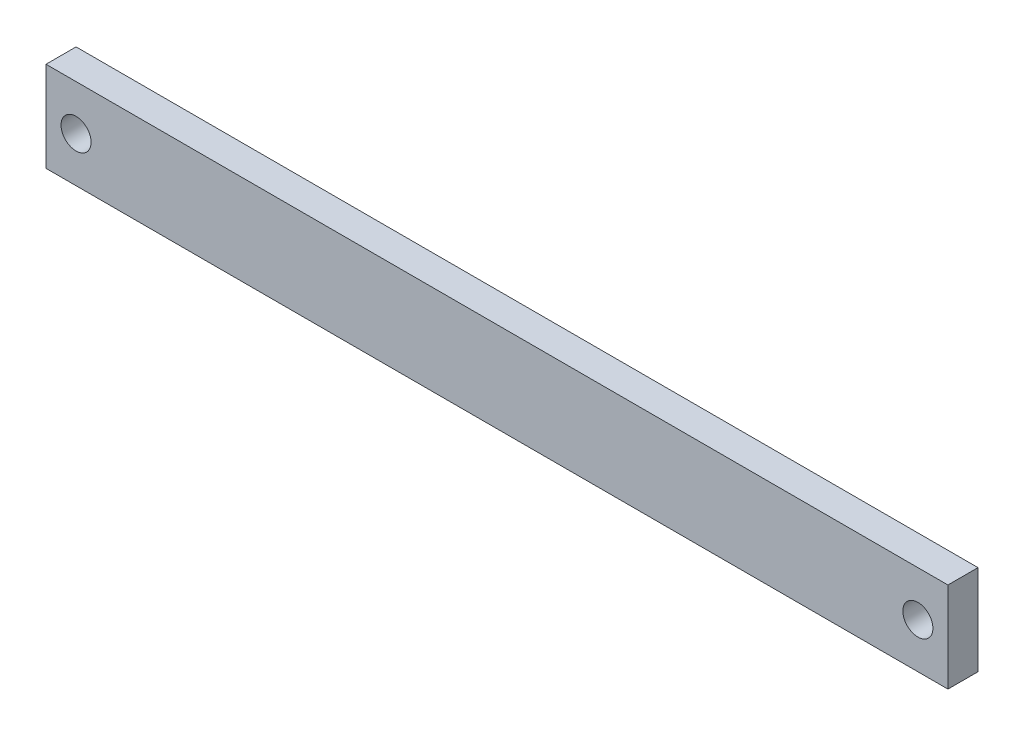
from build123d import *

# Parameters (mm, degrees)
SKETCH1_W           = 150
SKETCH1_H           = 15
SKETCH1_R           = 2.5
BOSS_EXTRUDE1_DEPTH = 5


with BuildPart() as part:
    # Sketch1 → Boss-Extrude1 (new body)
    with BuildSketch(Plane.XY):
        Rectangle(SKETCH1_W, SKETCH1_H)
        with Locations((70, 0)):
            Circle(SKETCH1_R, mode=Mode.SUBTRACT)
        with Locations((-70, 0)):
            Circle(SKETCH1_R, mode=Mode.SUBTRACT)
    extrude(amount=BOSS_EXTRUDE1_DEPTH)


solid = part.part
